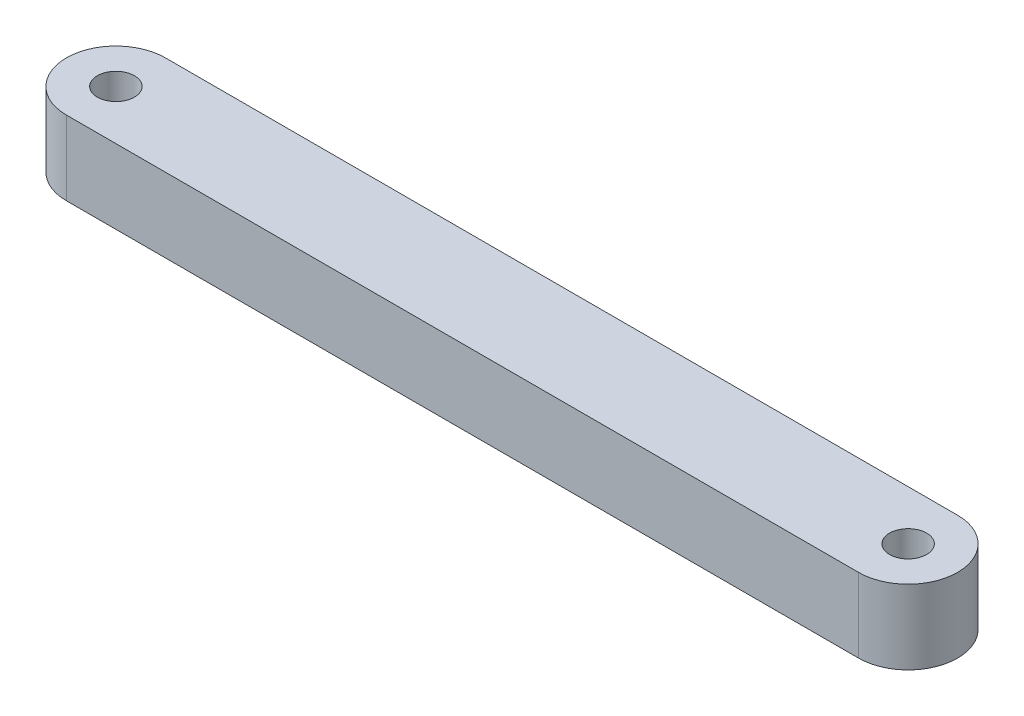
from build123d import *

# Parameters (mm, degrees)
BOSS_EXTRUDE1_DEPTH = 15
SKETCH6_R           = 3.75
CUT_EXTRUDE3_DEPTH  = 10
SKETCH8_R           = 3.75
CUT_EXTRUDE4_DEPTH  = 10


with BuildPart() as part:
    # Sketch1 → Boss-Extrude1 (new body)
    with BuildSketch(Plane(origin=(0, 0, 0), x_dir=(1, 0, 0), z_dir=(0, 1, 0))):
        with BuildLine():
            Line((-80, 10), (80, 10))
            ThreePointArc((80, 10), (90, 0), (80, -10))
            Line((80, -10), (-80, -10))
            ThreePointArc((-80, -10), (-90, 0), (-80, 10))
        make_face()
    extrude(amount=BOSS_EXTRUDE1_DEPTH)

    # Sketch6 → Cut-Extrude3 (cut)
    with BuildSketch(Plane(origin=(0, 15, 0), x_dir=(1, 0, 0), z_dir=(0, 1, 0))):
        with Locations(Location((80, 0, 0), (0, 0, 270))):
            Circle(SKETCH6_R)
    extrude(amount=-CUT_EXTRUDE3_DEPTH, mode=Mode.SUBTRACT)

    # Sketch8 → Cut-Extrude4 (cut)
    with BuildSketch(Plane(origin=(0, 15, 0), x_dir=(1, 0, 0), z_dir=(0, 1, 0))):
        with Locations(Location((-80, 0, 0), (0, 0, 270))):
            Circle(SKETCH8_R)
    extrude(amount=-CUT_EXTRUDE4_DEPTH, mode=Mode.SUBTRACT)


solid = part.part
